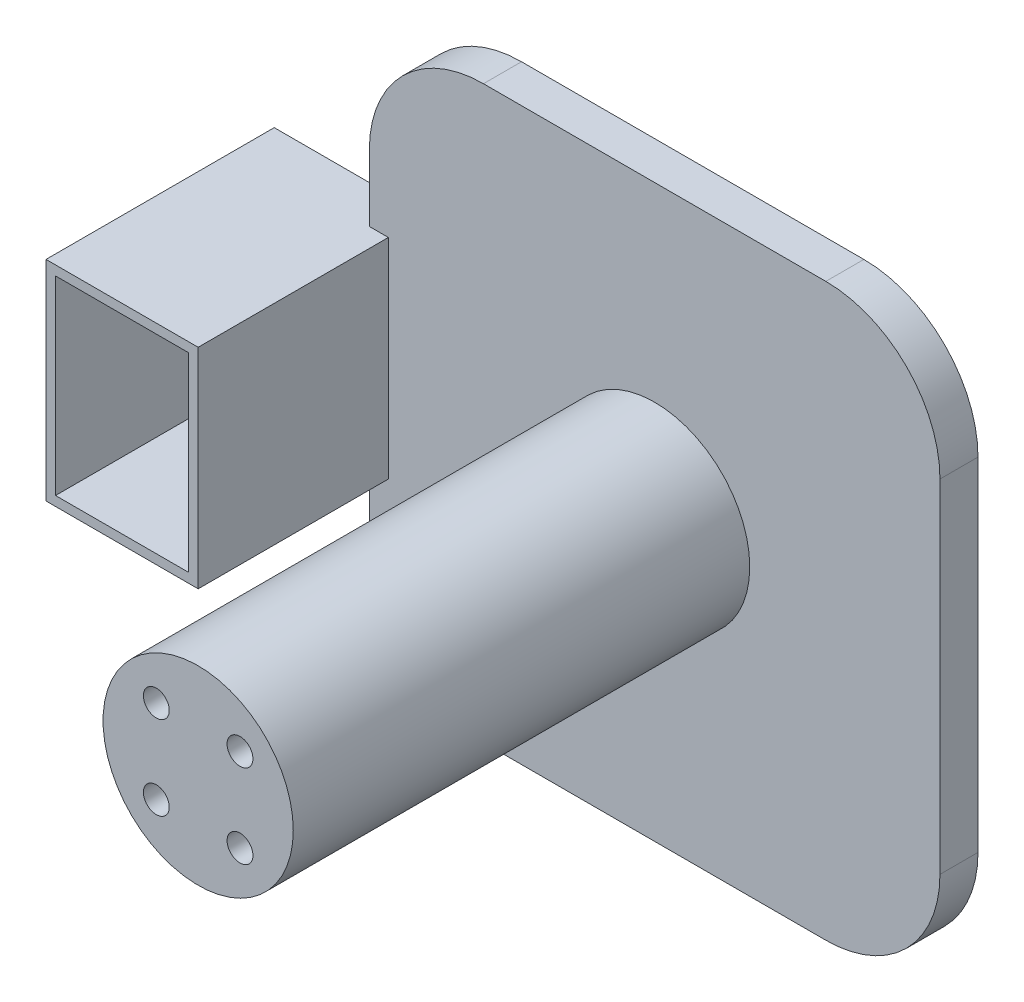
from build123d import *

# Parameters (mm, degrees)
EXTRUDE_1_DEPTH     = 10
EXTRUDE_2_DEPTH     = 120
CUT_EXTRUDE_1_DEPTH = 10
EXTRUDE_3_DEPTH     = 10
SKETCH_8_W          = 35
SKETCH_8_H          = 50
EXTRUDE_4_DEPTH     = 50


with BuildPart() as part:
    # 草图1 → 凸台-拉伸1 (new body)
    with BuildSketch(Plane.XY):
        with BuildLine():
            Line((30, 0), (120, 0))
            ThreePointArc((120, 0), (141.213203436, 8.786796564), (150, 30))
            Line((150, 30), (150, 120))
            ThreePointArc((150, 120), (141.213203436, 141.213203436), (120, 150))
            Line((120, 150), (30, 150))
            ThreePointArc((30, 150), (8.786796564, 141.213203436), (0, 120))
            Line((0, 120), (0, 30))
            ThreePointArc((0, 30), (8.786796564, 8.786796564), (30, 0))
        make_face()
    extrude(amount=EXTRUDE_1_DEPTH)

    # 草图2 → 凸台-拉伸2 (add)
    with BuildSketch(Plane.XY.offset(10)):
        with BuildLine():
            ThreePointArc((100, 75), (84.567085809, 98.096988313), (57.32233047, 92.67766953))
            Line((57.32233047, 92.67766953), (92.67766953, 57.32233047))
            ThreePointArc((92.67766953, 57.32233047), (98.096988313, 65.432914191), (100, 75))
        make_face()
        with BuildLine():
            Line((92.67766953, 57.32233047), (57.32233047, 92.67766953))
            ThreePointArc((57.32233047, 92.67766953), (57.32233047, 57.32233047), (92.67766953, 57.32233047))
        make_face()
    extrude(amount=EXTRUDE_2_DEPTH)

    # 草图5 → 切除-拉伸1 (cut)
    with BuildSketch(Plane.XY.offset(130)):
        with BuildLine():
            ThreePointArc((67.4, 86), (61.595836944, 88.404163056), (64, 82.6))
            Line((64, 82.6), (64, 86))
            Line((64, 86), (67.4, 86))
        make_face()
        with BuildLine():
            Line((64, 86), (64, 82.6))
            ThreePointArc((64, 82.6), (66.404163056, 83.595836944), (67.4, 86))
            Line((67.4, 86), (64, 86))
        make_face()
        with BuildLine():
            Line((64, 67.4), (64, 64))
            Line((64, 64), (67.4, 64))
            ThreePointArc((67.4, 64), (66.404163056, 66.404163056), (64, 67.4))
        make_face()
        with BuildLine():
            Line((67.4, 64), (64, 64))
            Line((64, 64), (64, 67.4))
            ThreePointArc((64, 67.4), (61.595836944, 61.595836944), (67.4, 64))
        make_face()
        with BuildLine():
            ThreePointArc((86, 67.4), (83.595836944, 66.404163056), (82.6, 64))
            Line((82.6, 64), (86, 64))
            Line((86, 64), (86, 67.4))
        make_face()
        with BuildLine():
            Line((86, 64), (82.6, 64))
            ThreePointArc((82.6, 64), (86, 60.6), (89.4, 64))
            ThreePointArc((89.4, 64), (88.404163056, 66.404163056), (86, 67.4))
            Line((86, 67.4), (86, 64))
        make_face()
        with BuildLine():
            ThreePointArc((82.6, 86), (83.595836944, 83.595836944), (86, 82.6))
            Line((86, 82.6), (86, 86))
            Line((86, 86), (82.6, 86))
        make_face()
        with BuildLine():
            Line((86, 86), (86, 82.6))
            ThreePointArc((86, 82.6), (88.404163056, 83.595836944), (89.4, 86))
            ThreePointArc((89.4, 86), (86, 89.4), (82.6, 86))
            Line((82.6, 86), (86, 86))
        make_face()
    extrude(amount=-CUT_EXTRUDE_1_DEPTH, mode=Mode.SUBTRACT)

    # 草图7 → 凸台-拉伸3 (add, through all)
    with BuildSketch(Plane.XY.offset(10)):
        Polygon((0, 102.5), (-35, 102.5), (-35, 47.5), (0, 47.5), (0, 75), align=None)
    extrude(amount=-EXTRUDE_3_DEPTH)

    # 草图8 → 凸台-拉伸4 (add)
    with BuildSketch(Plane.XY.offset(10)):
        Polygon((-35, 102.5), (0, 102.5), (5, 102.5), (5, 47.5), (0, 47.5), (-35, 47.5), align=None)
        with Locations((-15, 75)):
            Rectangle(SKETCH_8_W, SKETCH_8_H, mode=Mode.SUBTRACT)
    extrude(amount=EXTRUDE_4_DEPTH)


solid = part.part
